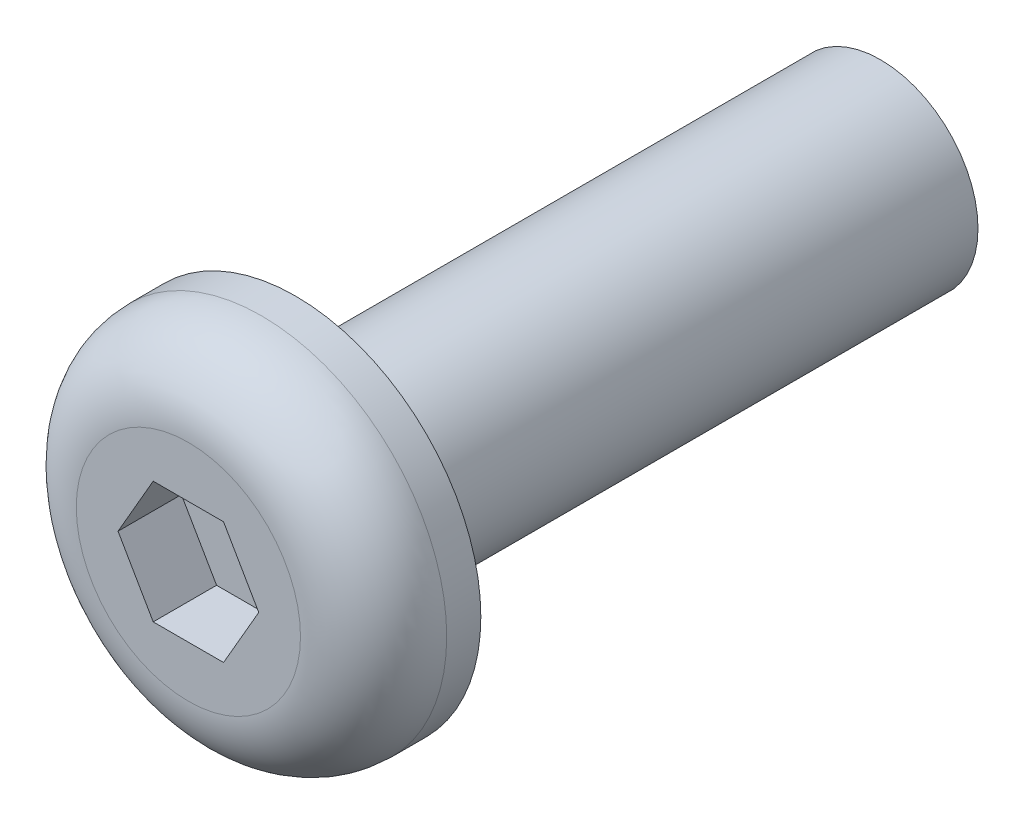
from build123d import *

# Parameters (mm, degrees)
SKETCH1_R      = 2
SHANK_DEPTH    = 12
SKETCH2_R      = 3.8
HEAD_DEPTH     = 2.2
BUTTON_ROUND_R = 1.5
SOCKET_DEPTH   = 1.3


with BuildPart() as part:
    # Sketch1 → Shank (new body)
    with BuildSketch(Plane.XY):
        Circle(SKETCH1_R)
    extrude(amount=SHANK_DEPTH)

    # Sketch2 → Head (add)
    with BuildSketch(Plane.XY.offset(12)):
        Circle(SKETCH2_R)
    extrude(amount=HEAD_DEPTH)

    # Button_round
    button_round_edges = [part.edges().sort_by_distance(p)[0] for p in [
        (-3.8, 0, 14.2),
    ]]
    fillet(button_round_edges, radius=BUTTON_ROUND_R)

    # Sketch3 → Socket (cut)
    with BuildSketch(Plane.XY.offset(12.9)):
        Polygon((1.443375673, 0), (0.721687836, 1.25), (-0.721687836, 1.25), (-1.443375673, 0), (-0.721687836, -1.25), (0.721687836, -1.25), align=None)
    extrude(amount=SOCKET_DEPTH, mode=Mode.SUBTRACT)


solid = part.part
